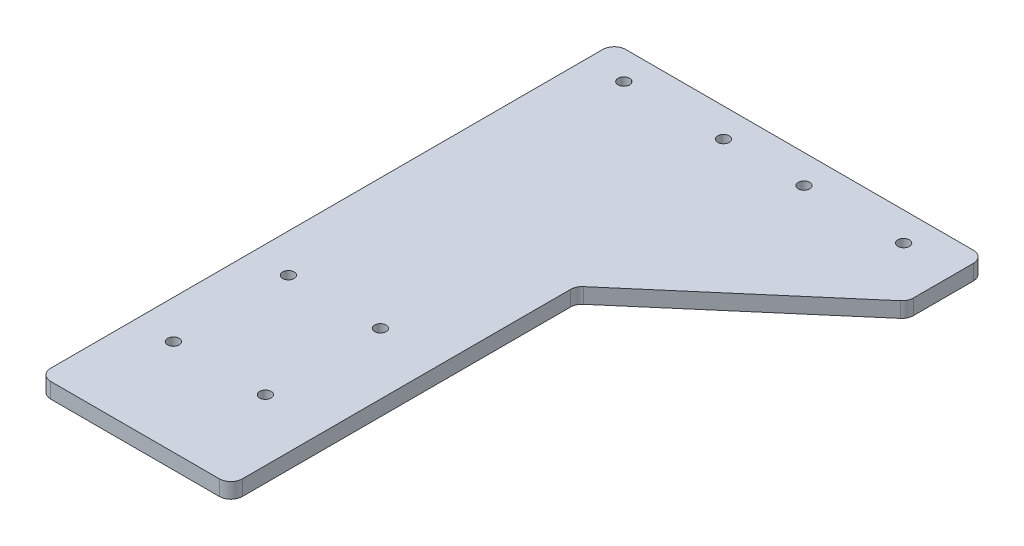
from build123d import *

# Parameters (mm, degrees)
EXTRUDE_1_DEPTH     = 4
SKETCH_2_R          = 1.5
CUT_EXTRUDE_1_DEPTH = 4
SKETCH_3_R          = 1.5
CUT_EXTRUDE_2_DEPTH = 4
CUT_EXTRUDE_3_DEPTH = 10
CUT_EXTRUDE_5_DEPTH = 10
CUT_EXTRUDE_6_DEPTH = 10
FILLET_1_R          = 3


with BuildPart() as part:
    # 草图1 → 凸台-拉伸1 (new body)
    with BuildSketch(Plane(origin=(0, 0, 0), x_dir=(1, 0, 0), z_dir=(0, 1, 0))):
        Polygon((100, 150), (75, 0), (0, 0), (0, 150), align=None)
    extrude(amount=EXTRUDE_1_DEPTH)

    # 草图2 → 切除-拉伸1 (cut)
    with BuildSketch(Plane(origin=(0, 4, 0), x_dir=(1, 0, 0), z_dir=(0, 1, 0))):
        with Locations(Location((10, 25, 0), (0, 0, 270))):
            Circle(SKETCH_2_R)
        with Locations(Location((34, 55, 0), (0, 0, 270))):
            Circle(SKETCH_2_R)
        with Locations(Location((34, 25, 0), (0, 0, 270))):
            Circle(SKETCH_2_R)
        with Locations(Location((10, 55, 0), (0, 0, 270))):
            Circle(SKETCH_2_R)
    extrude(amount=-CUT_EXTRUDE_1_DEPTH, mode=Mode.SUBTRACT)

    # 草图3 → 切除-拉伸2 (cut)
    with BuildSketch(Plane(origin=(0, 4, 0), x_dir=(1, 0, 0), z_dir=(0, 1, 0))):
        with Locations(Location((10, 142.5, 0), (0, 0, 270))):
            Circle(SKETCH_3_R)
        with Locations(Location((36, 142.5, 0), (0, 0, 270))):
            Circle(SKETCH_3_R)
        with Locations(Location((57, 142.5, 0), (0, 0, 270))):
            Circle(SKETCH_3_R)
        with Locations(Location((83, 142.5, 0), (0, 0, 270))):
            Circle(SKETCH_3_R)
    extrude(amount=-CUT_EXTRUDE_2_DEPTH, mode=Mode.SUBTRACT)

    # 草图4 → 切除-拉伸3 (cut)
    with BuildSketch(Plane(origin=(0, 4, 0), x_dir=(1, 0, 0), z_dir=(0, 1, 0))):
        Polygon((121.630506201, 0), (50, 0), (50, 90), (150.537772798, 90), align=None)
    extrude(amount=-CUT_EXTRUDE_3_DEPTH, mode=Mode.SUBTRACT)

    # 草图5 → 切除-拉伸5 (cut)
    with BuildSketch(Plane(origin=(0, 4, 0), x_dir=(1, 0, 0), z_dir=(0, 1, 0))):
        Polygon((150.2124031, 125.352298199), (66.770540327, 64.546264366), (50, 90), (96.666666667, 130), align=None)
    extrude(amount=-CUT_EXTRUDE_5_DEPTH, mode=Mode.SUBTRACT)

    # 草图6 → 切除-拉伸6 (cut)
    with BuildSketch(Plane(origin=(0, 4, 0), x_dir=(1, 0, 0), z_dir=(0, 1, 0))):
        Polygon((96.666666667, 130), (140.554271479, 130), (107.506476867, 160.861157787), (96.666666667, 160.861157787), align=None)
    extrude(amount=-CUT_EXTRUDE_6_DEPTH, mode=Mode.SUBTRACT)

    # 圆角1
    fillet_1_edges = [part.edges().sort_by_distance(p)[0] for p in [
        (50, 2, -90),
        (50, 2, 0),
        (96.666666667, 2, -130),
        (0, 2, -150),
        (0, 2, 0),
        (96.666666667, 2, -150),
    ]]
    fillet(fillet_1_edges, radius=FILLET_1_R)


solid = part.part
